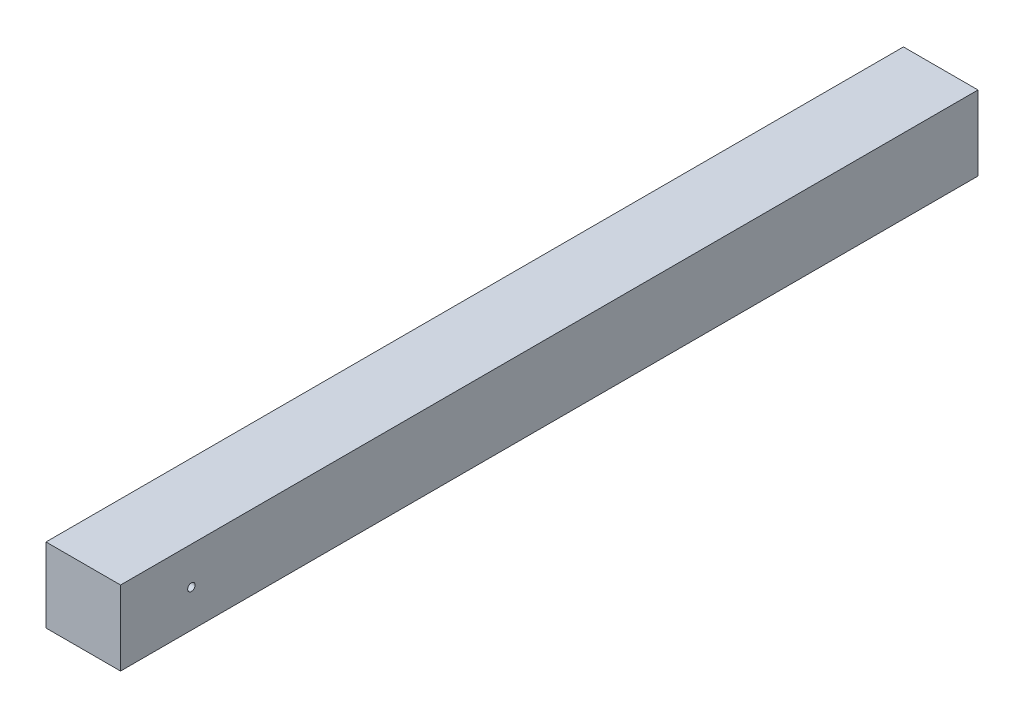
from build123d import *

# Parameters (mm, degrees)
SKETCH1_W           = 100
SKETCH1_H           = 100
BOSS_EXTRUDE1_DEPTH = 575
SKETCH2_R           = 5
CUT_EXTRUDE1_DEPTH  = 586.768725693


with BuildPart() as part:
    # Sketch1 → Boss-Extrude1 (new, symmetric)
    with BuildSketch(Plane.XY):
        Rectangle(SKETCH1_W, SKETCH1_H)
    extrude(amount=BOSS_EXTRUDE1_DEPTH, both=True)

    # Sketch2 → Cut-Extrude1 (cut, through all)
    with BuildSketch(Plane(origin=(50, 0, 0), x_dir=(0, 0, -1), z_dir=(1, 0, 0))):
        with Locations((-480, 0)):
            Circle(SKETCH2_R)
    extrude(amount=-CUT_EXTRUDE1_DEPTH, mode=Mode.SUBTRACT)


solid = part.part
